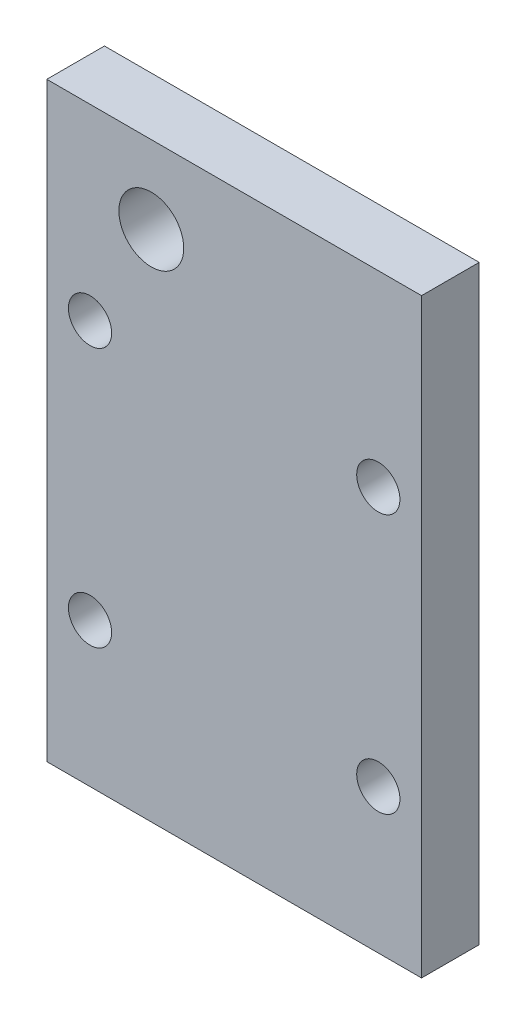
from build123d import *

# Parameters (mm, degrees)
SKETCH1_W           = 26
SKETCH1_H           = 41
SKETCH1_R           = 2.25
SKETCH1_R_2         = 1.5
BOSS_EXTRUDE1_DEPTH = 4


with BuildPart() as part:
    # Sketch1 → Boss-Extrude1 (new body)
    with BuildSketch(Plane.XY):
        with Locations((13, 20.5)):
            Rectangle(SKETCH1_W, SKETCH1_H)
        with Locations((7.25, 35.6)):
            Circle(SKETCH1_R, mode=Mode.SUBTRACT)
        with Locations((3, 28)):
            Circle(SKETCH1_R_2, mode=Mode.SUBTRACT)
        with Locations((3, 10)):
            Circle(SKETCH1_R_2, mode=Mode.SUBTRACT)
        with Locations(Location((23, 10, 0), (0, 0, 180))):
            Circle(SKETCH1_R_2, mode=Mode.SUBTRACT)
        with Locations(Location((23, 28, 0), (0, 0, 180))):
            Circle(SKETCH1_R_2, mode=Mode.SUBTRACT)
    extrude(amount=BOSS_EXTRUDE1_DEPTH)


solid = part.part
